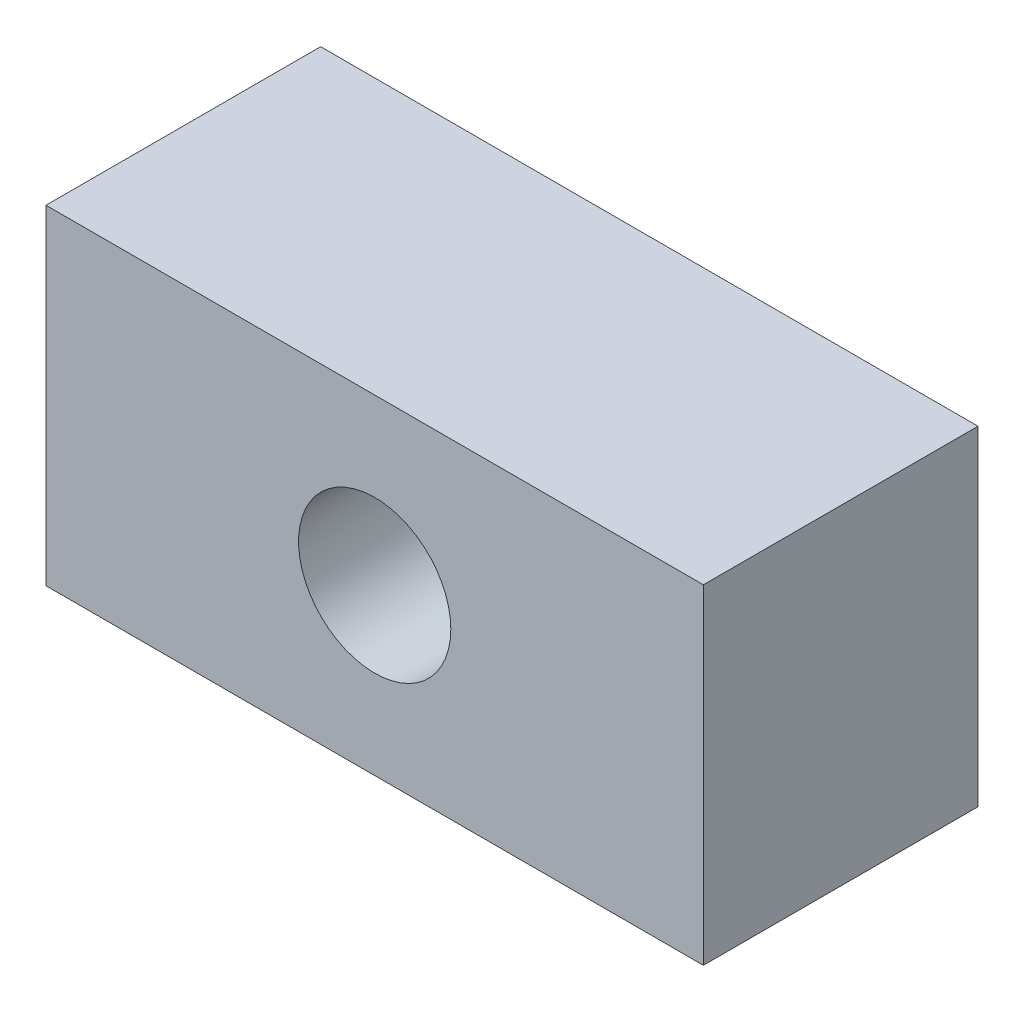
from build123d import *

# Parameters (mm, degrees)
SKETCH1_W               = 15.875
SKETCH1_H               = 19.05
BOSS_EXTRUDE1_DEPTH     = 19
M10X1_25_TAPPED_HOLE1_D = 8.8


with BuildPart() as part:
    # Sketch1 → Boss-Extrude1 (new, symmetric)
    with BuildSketch(Plane(origin=(0, 0, 0), x_dir=(0, 0, -1), z_dir=(1, 0, 0))):
        Rectangle(SKETCH1_W, SKETCH1_H)
    extrude(amount=BOSS_EXTRUDE1_DEPTH, both=True)

    # M10x1.25 Tapped Hole1 (through all)
    with Locations(Plane.XY.offset(7.9375)):
        with Locations((0, 0)):
            Hole(M10X1_25_TAPPED_HOLE1_D / 2)


solid = part.part
